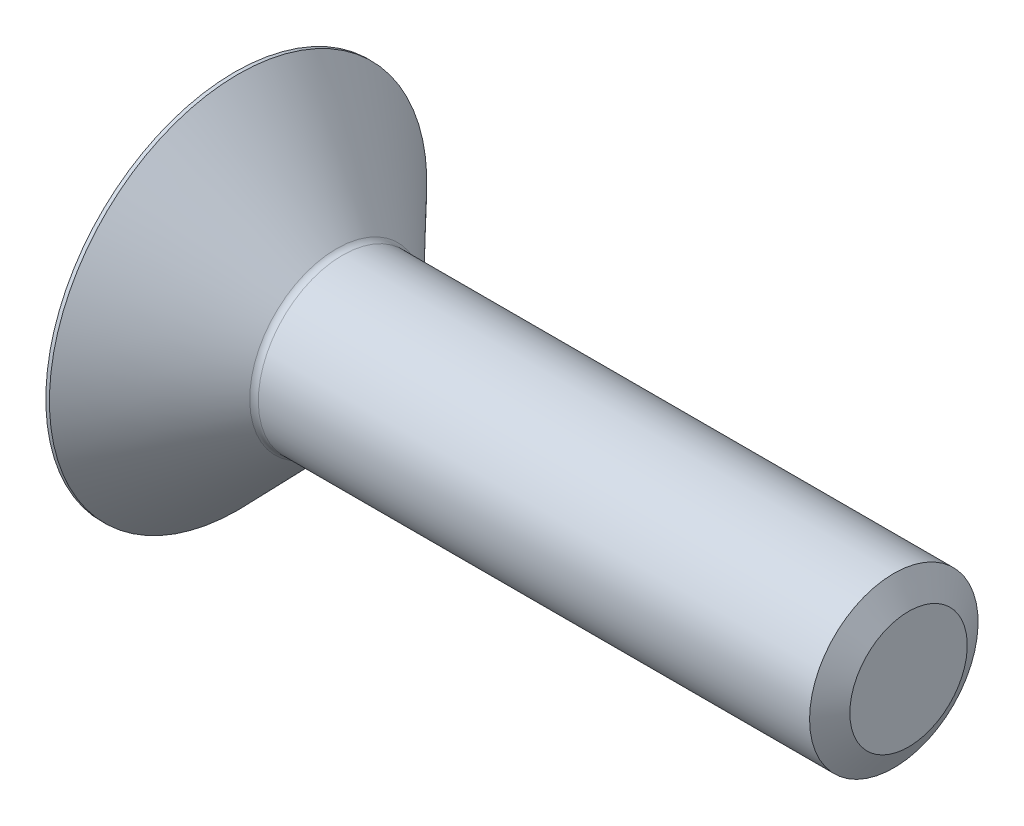
from build123d import *

# Parameters (mm, degrees)
CUT_EXTRUDE_1_DEPTH = 2.58


with BuildPart() as part:
    # 草图1 → 旋转1 (revolve)
    with BuildSketch(Plane.XY):
        with BuildLine():
            Line((0, 2), (-13.435105037, 2))
            ThreePointArc((-13.435105037, 2), (-13.513251262, 2.015899029), (-13.578972997, 2.061068326))
            Line((-13.578972997, 2.061068326), (-15.914908162, 4.48))
            Line((-15.914908162, 4.48), (-16, 4.48))
            Line((-16, 4.48), (-16, 0))
            Line((-16, 0), (0, 0))
            Line((0, 0), (0, 2))
        make_face()
    revolve(axis=Axis((0, 0, 0), (-1, 0, 0)))

    # 草图2 → 切除-拉伸1 (cut)
    with BuildSketch(Plane.ZY.offset(16)):
        Polygon((0, 1.443375673), (-1.25, 0.721687836), (-1.25, -0.721687836), (0, -1.443375673), (1.25, -0.721687836), (1.25, 0.721687836), align=None)
    extrude(amount=-CUT_EXTRUDE_1_DEPTH, mode=Mode.SUBTRACT)

    # 草图6 → 旋转2 (revolve)
    with BuildSketch(Plane.XY):
        Polygon((-14.5, 1.443375673), (-13.666666667, 0), (-13.05, 0), (-13.05, 1.443375673), align=None)
    revolve(axis=Axis((-16, 0, 0), (1, 0, 0)))

    # 草图7 → 切除-旋转2 (revolve, cut)
    with BuildSketch(Plane.XY):
        Polygon((-16, 1.443375673), (-16, 0), (-15.593, 0), align=None)
    revolve(axis=Axis((-16, 0, 0), (1, 0, 0)), mode=Mode.SUBTRACT)

    # 草图4 → 切除-旋转1 (revolve, cut)
    with BuildSketch(Plane.XY):
        Polygon((-0.35, 2), (0, 1.393782217), (0.35, 2), align=None)
    revolve(axis=Axis((-0.35, 0, 0), (1, 0, 0)), mode=Mode.SUBTRACT)


solid = part.part
